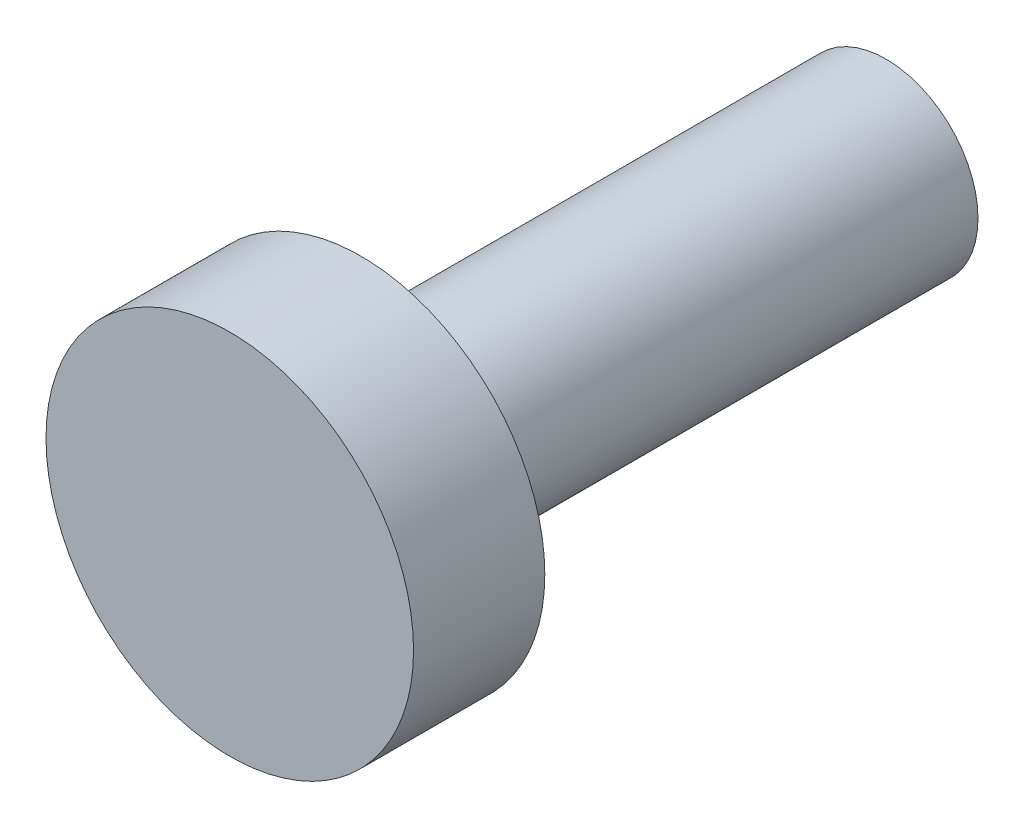
from build123d import *

# Parameters (mm, degrees)
SKETCH1_R           = 1.75
BOSS_EXTRUDE1_DEPTH = 10
SKETCH2_R           = 3.5
BOSS_EXTRUDE2_DEPTH = 2.5


with BuildPart() as part:
    # Sketch1 → Boss-Extrude1 (new body)
    with BuildSketch(Plane.XY):
        Circle(SKETCH1_R)
    extrude(amount=BOSS_EXTRUDE1_DEPTH)

    # Sketch2 → Boss-Extrude2 (add)
    with BuildSketch(Plane.XY.offset(10)):
        Circle(SKETCH2_R)
    extrude(amount=BOSS_EXTRUDE2_DEPTH)


solid = part.part
